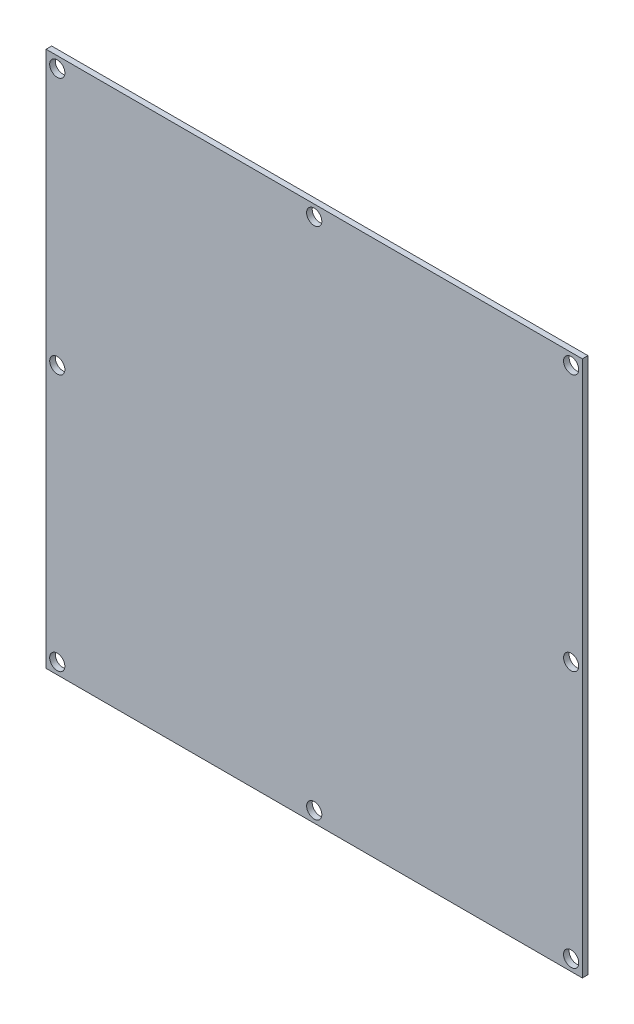
from build123d import *

# Parameters (mm, degrees)
SKETCH1_W           = 152.4
SKETCH1_H           = 152.4
BOSS_EXTRUDE1_DEPTH = 1.5875
SKETCH2_R           = 2.159
CUT_EXTRUDE1_DEPTH  = 216.531993347


with BuildPart() as part:
    # Sketch1 → Boss-Extrude1 (new body)
    with BuildSketch(Plane.XY):
        with Locations((76.2, 76.2)):
            Rectangle(SKETCH1_W, SKETCH1_H)
    extrude(amount=BOSS_EXTRUDE1_DEPTH)

    # Sketch2 → Cut-Extrude1 (cut, through all)
    with BuildSketch(Plane.XY.offset(1.5875)):
        with Locations((3.175, 149.225)):
            Circle(SKETCH2_R)
        with Locations((76.2, 149.225)):
            Circle(SKETCH2_R)
        with Locations((149.225, 149.225)):
            Circle(SKETCH2_R)
        with Locations((3.175, 3.175)):
            Circle(SKETCH2_R)
        with Locations((149.225, 3.175)):
            Circle(SKETCH2_R)
        with Locations((149.225, 76.2)):
            Circle(SKETCH2_R)
        with Locations((3.175, 76.2)):
            Circle(SKETCH2_R)
        with Locations((76.2, 3.175)):
            Circle(SKETCH2_R)
    extrude(amount=-CUT_EXTRUDE1_DEPTH, mode=Mode.SUBTRACT)


solid = part.part
